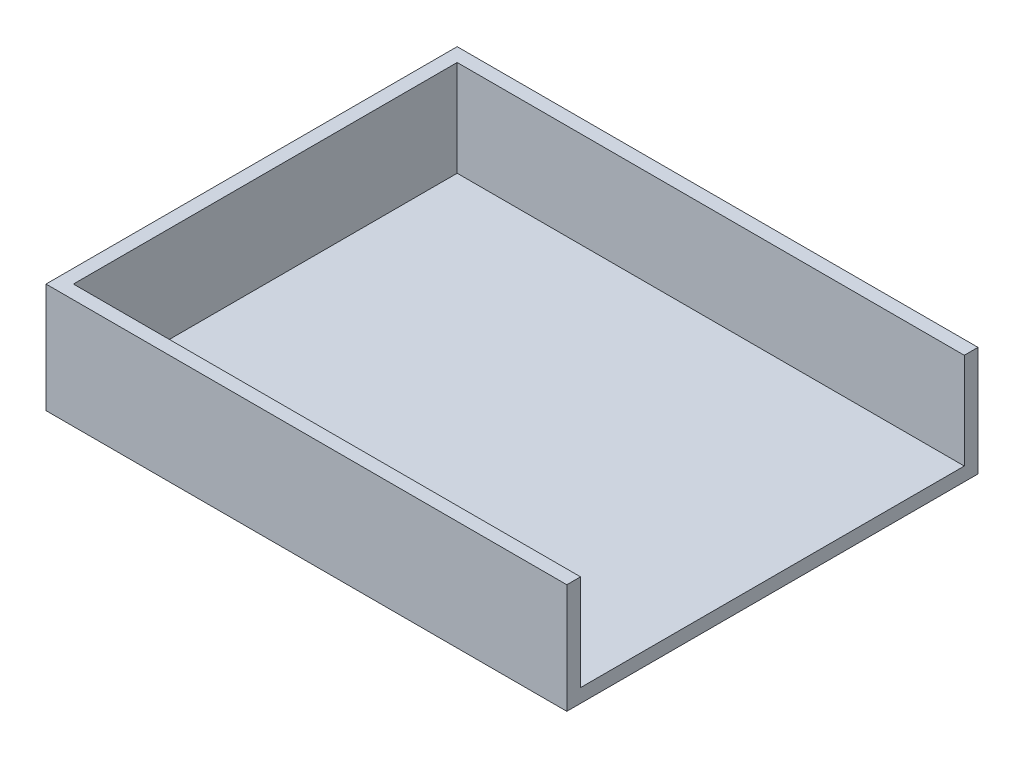
from build123d import *

# Parameters (mm, degrees)
SKETCH_1_W          = 38
SKETCH_1_H          = 30
EXTRUDE_1_DEPTH     = 8
CUT_EXTRUDE_START   = 1
SKETCH_2_W          = 37
SKETCH_2_H          = 28
CUT_EXTRUDE_1_DEPTH = 7
EXTRUDE_START       = 8
SKETCH_4_W          = 38
SKETCH_4_H          = 30
EXTRUDE_3_DEPTH     = 1
CUT_EXTRUDE_START_2 = 9
SKETCH_5_R          = 11
CUT_EXTRUDE_2_DEPTH = 1
SKETCH_6_W          = 38
SKETCH_6_H          = 30
CUT_EXTRUDE_3_DEPTH = 1


with BuildPart() as part:
    # 스케치1 → 보스-돌출1 (new body)
    with BuildSketch(Plane(origin=(0, 0, 0), x_dir=(1, 0, 0), z_dir=(0, 1, 0))):
        Rectangle(SKETCH_1_W, SKETCH_1_H)
    extrude(amount=EXTRUDE_1_DEPTH)

    # 스케치2 → 컷-돌출1 (cut)
    with BuildSketch(Plane(origin=(0, 0, 0), x_dir=(1, 0, 0), z_dir=(0, 1, 0)).offset(CUT_EXTRUDE_START)):
        with Locations((0.5, 0)):
            Rectangle(SKETCH_2_W, SKETCH_2_H)
    extrude(amount=CUT_EXTRUDE_1_DEPTH, mode=Mode.SUBTRACT)


with BuildPart() as body_2:
    # 스케치4 → 보스-돌출3 (new body)
    with BuildSketch(Plane(origin=(0, 0, 0), x_dir=(1, 0, 0), z_dir=(0, 1, 0)).offset(EXTRUDE_START)):
        Rectangle(SKETCH_4_W, SKETCH_4_H)
    extrude(amount=EXTRUDE_3_DEPTH)

    # 스케치5 → 컷-돌출2 (cut)
    with BuildSketch(Plane(origin=(0, 0, 0), x_dir=(1, 0, 0), z_dir=(0, 1, 0)).offset(CUT_EXTRUDE_START_2)):
        with Locations(Location((-1, 0, 0), (0, 0, 270))):
            Circle(SKETCH_5_R)
    extrude(amount=-CUT_EXTRUDE_2_DEPTH, mode=Mode.SUBTRACT)

    # 스케치6 → 컷-돌출3 (cut)
    with BuildSketch(Plane(origin=(0, 9, 0), x_dir=(1, 0, 0), z_dir=(0, 1, 0))):
        Rectangle(SKETCH_6_W, SKETCH_6_H)
    extrude(amount=-CUT_EXTRUDE_3_DEPTH, mode=Mode.SUBTRACT)


solid = part.part
